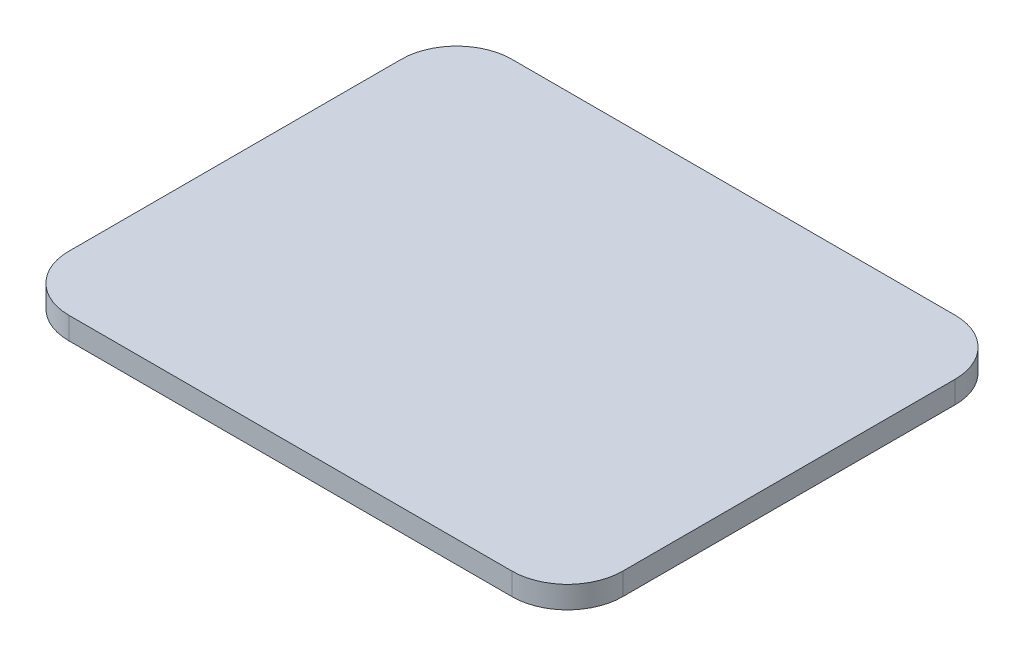
from build123d import *

# Parameters (mm, degrees)
SKETCH1_W           = 500
SKETCH1_H           = 400
BOSS_EXTRUDE1_DEPTH = 20
FILLET1_R           = 50


with BuildPart() as part:
    # Sketch1 → Boss-Extrude1 (new body)
    with BuildSketch(Plane(origin=(0, 0, 0), x_dir=(1, 0, 0), z_dir=(0, 1, 0))):
        Rectangle(SKETCH1_W, SKETCH1_H)
    extrude(amount=BOSS_EXTRUDE1_DEPTH)

    # Fillet1
    fillet1_edges = [part.edges().sort_by_distance(p)[0] for p in [
        (250, 10, 200),
        (-250, 10, 200),
        (-250, 10, -200),
        (250, 10, -200),
    ]]
    fillet(fillet1_edges, radius=FILLET1_R)


solid = part.part
